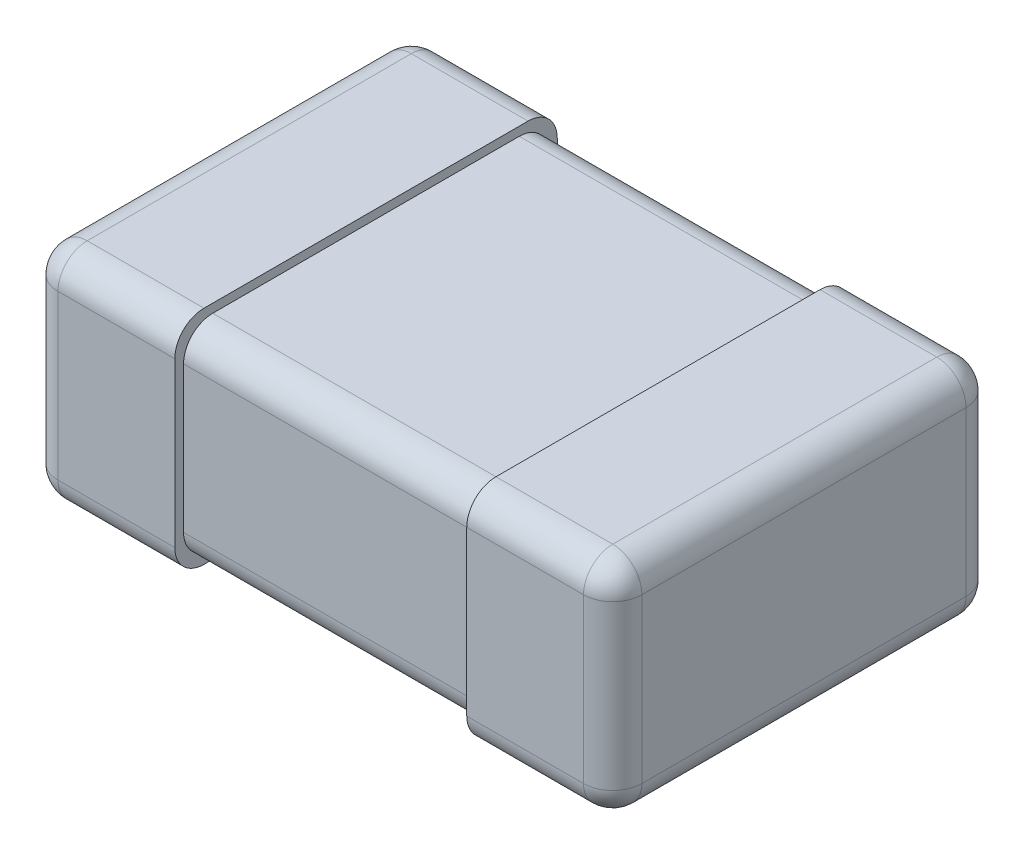
from build123d import *

# Parameters (mm, degrees)
SKETCH1_W           = 2
SKETCH1_H           = 1.25
EXTRUDE1_DEPTH      = 0.7
EXTRUDE2_DEPTH      = 0.655
EXTRUDE2_DEPTH_BACK = 0.655
SKETCH2_W           = 0.5
SKETCH2_H           = 0.76
FILLET1_R           = 0.1


with BuildPart() as part:
    # Sketch1 → Extrude1 (new body)
    with BuildSketch(Plane(origin=(0, 0, 0), x_dir=(1, 0, 0), z_dir=(0, 1, 0))):
        Rectangle(SKETCH1_W, SKETCH1_H)
    extrude(amount=EXTRUDE1_DEPTH)

    # Sketch2 → Extrude2 (add, two sides: drawn at the far end of the back side and taken through both)
    with BuildSketch(Plane.XY.offset(-EXTRUDE2_DEPTH_BACK)):
        with Locations((-0.75, 0.35)):
            Rectangle(SKETCH2_W, SKETCH2_H)
        with Locations((0.75, 0.35)):
            Rectangle(SKETCH2_W, SKETCH2_H)
    extrude(amount=EXTRUDE2_DEPTH + EXTRUDE2_DEPTH_BACK)

    # Fillet1
    fillet1_edges = [part.edges().sort_by_distance(p)[0] for p in [
        (-1, 0.35, 0.655),
        (-1, 0.73, 0),
        (-1, 0.35, -0.655),
        (-1, -0.03, 0),
        (-0.75, 0.73, 0.655),
        (-0.75, -0.03, 0.655),
        (-0.75, 0.73, -0.655),
        (-0.75, -0.03, -0.655),
        (0, 0, 0.625),
        (0, 0, -0.625),
        (0, 0.7, 0.625),
        (0, 0.7, -0.625),
        (1, -0.03, 0),
        (0.75, -0.03, 0.655),
        (0.75, -0.03, -0.655),
        (1, 0.35, 0.655),
        (0.75, 0.73, 0.655),
        (1, 0.35, -0.655),
        (0.75, 0.73, -0.655),
        (1, 0.73, 0),
    ]]
    fillet(fillet1_edges, radius=FILLET1_R)


solid = part.part
